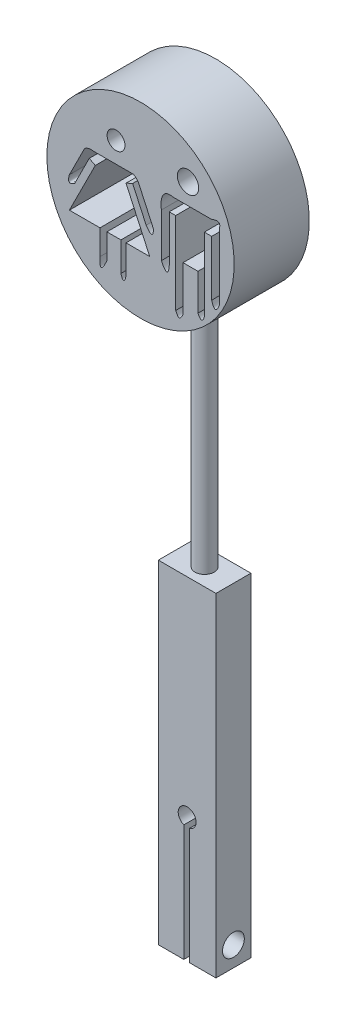
from build123d import *

# Parameters (mm, degrees)
BOSS_EXTRUDE1_DEPTH      = 3.913307776
BOSS_EXTRUDE1_DEPTH_BACK = 0.0001
SKETCH1_W                = 6.447640287
SKETCH1_H                = 37.279047993
SKETCH4_R                = 1.068953687
BOSS_EXTRUDE2_DEPTH      = 37.846
BOSS_EXTRUDE6_DEPTH      = 0.000254
BOSS_EXTRUDE6_DEPTH_BACK = 8.407164958
SKETCH12_R               = 10.48399754
CUT_EXTRUDE4_DEPTH       = 98.663499601
CUT_EXTRUDE4_DEPTH_BACK  = 98.663499601
SKETCH13_R               = 1.19545429
SKETCH13_R_2             = 1.000054771
CUT_EXTRUDE5_DEPTH       = 96.210872711
CUT_EXTRUDE5_DEPTH_BACK  = 96.210872711
SKETCH14_R               = 1
CUT_EXTRUDE6_DEPTH       = 95.94538111
CUT_EXTRUDE6_DEPTH_BACK  = 95.94538111
SKETCH16_W               = 0.623837717
SKETCH16_H               = 17.643046147
CUT_EXTRUDE7_DEPTH       = 83.930679745
CUT_EXTRUDE7_DEPTH_BACK  = 83.930679745
SKETCH17_R               = 1.2192


with BuildPart() as part:
    # Sketch1 → Boss-Extrude1 (new, two sides: drawn at the far end of the back side and taken through both)
    with BuildSketch(Plane.XY.offset(-BOSS_EXTRUDE1_DEPTH_BACK)):
        with Locations((-37.332434681, 14.942660153)):
            Rectangle(SKETCH1_W, SKETCH1_H)
    extrude(amount=BOSS_EXTRUDE1_DEPTH + BOSS_EXTRUDE1_DEPTH_BACK)

    # Sketch4 → Boss-Extrude2 (add)
    with BuildSketch(Plane(origin=(0, 33.582184149, 0), x_dir=(1, 0, 0), z_dir=(0, 1, 0))):
        with Locations((-37.33243468, -1.956603888)):
            Circle(SKETCH4_R)
    extrude(amount=BOSS_EXTRUDE2_DEPTH)

    # Sketch12 → Boss-Extrude6 (add, two sides: drawn at the far end of the back side and taken through both)
    with BuildSketch(Plane(origin=(16.016807469, 0, -0.0001), x_dir=(-1, 0, 0), z_dir=(0, 0, -1)).offset(-BOSS_EXTRUDE6_DEPTH_BACK)):
        with Locations((54.07339326, 70.99141767)):
            Circle(SKETCH12_R)
    extrude(amount=BOSS_EXTRUDE6_DEPTH + BOSS_EXTRUDE6_DEPTH_BACK)

    # Sketch13 → Cut-Extrude4 (cut, two sides: drawn at the far end of the back side and taken through both)
    with BuildSketch(Plane(origin=(4.649934139, 0, -0.000354), x_dir=(-1, 0, 0), z_dir=(0, 0, -1)).offset(-CUT_EXTRUDE4_DEPTH_BACK)):
        with Locations((37.38999626, 76.398428276)):
            Circle(SKETCH13_R)
        with Locations((45.445209714, 76.398428276)):
            Circle(SKETCH13_R_2)
        with BuildLine():
            Line((34.741364568, 74.083543947), (39.031397516, 74.083543947))
            add(Edge.make_bspline(
                [(39.031397516, 74.083543947), (40.611597458, 74.408617634), (40.374079584, 72.184140047)],
                knots=[0, 0, 0, 1, 1, 1], degree=2))
            Line((40.374079584, 72.184140047), (40.374079584, 67.271888579))
            add(Edge.make_bspline(
                [(40.374079584, 67.271888579), (39.600283224, 65.680370015), (39.48987432, 67.271888579)],
                knots=[0, 0, 0, 1, 1, 1], degree=2))
            Line((39.48987432, 67.271888579), (39.48987432, 72.446126791))
            Line((39.48987432, 72.446126791), (38.769410771, 72.446126791))
            Line((38.769410771, 72.446126791), (38.769410771, 63.243842376))
            add(Edge.make_bspline(
                [(38.769410771, 63.243842376), (38.640061856, 62.984463054), (38.377383132, 62.457721647), (38.094358916, 62.979167961), (37.950702193, 63.243842376)],
                knots=[0, 0, 0, 0, 0.492422502, 1, 1, 1, 1], degree=3))
            Line((37.950702193, 63.243842376), (37.950702193, 68.287087216))
            Line((37.950702193, 68.287087216), (36.280536694, 68.287087216))
            Line((36.280536694, 68.287087216), (36.280536694, 64.22629267))
            add(Edge.make_bspline(
                [(36.280536694, 64.22629267), (35.838535516, 63.304970326), (35.560073146, 64.22629267)],
                knots=[0, 0, 0, 1, 1, 1], degree=2))
            Line((35.560073146, 64.22629267), (35.560073146, 72.446126791))
            Line((35.560073146, 72.446126791), (34.741364568, 72.446126791))
            Line((34.741364568, 72.446126791), (34.741364568, 66.256689943))
            add(Edge.make_bspline(
                [(34.741364568, 66.256689943), (34.368924716, 64.879813419), (33.857159304, 66.256689943)],
                knots=[0, 0, 0, 1, 1, 1], degree=2))
            Line((33.857159304, 66.256689943), (33.857159304, 73.723312173))
            add(Edge.make_bspline(
                [(33.857159304, 73.723312173), (33.677043417, 74.525646579), (34.741364568, 74.083543947)],
                knots=[0, 0, 0, 1, 1, 1], degree=2))
        make_face()
        with BuildLine():
            Line((43.52512733, 74.083543947), (47.989647858, 74.083543947))
            add(Edge.make_bspline(
                [(48.956960639, 73.864786766), (48.514088688, 74.173203304), (47.989647858, 74.083543947)],
                knots=[0, 0, 0, 1, 1, 1], degree=2))
            Line((48.956960639, 73.864786766), (50.668360175, 70.451132154))
            add(Edge.make_bspline(
                [(50.067248528, 69.912029472), (51.020492349, 69.269414741), (50.668360175, 70.451132154)],
                knots=[0, 0, 0, 1, 1, 1], degree=2))
            Line((50.067248528, 69.912029472), (48.445579149, 73.146703222))
            Line((48.445579149, 73.146703222), (47.766421831, 72.806214904))
            Line((47.766421831, 72.806214904), (50.668360175, 67.01784404))
            Line((50.668360175, 67.01784404), (47.245561103, 67.01784404))
            Line((47.245561103, 67.01784404), (47.245561103, 64.22629267))
            add(Edge.make_bspline(
                [(46.464270011, 64.22629267), (47.345300679, 62.244581833), (47.245561103, 64.22629267)],
                knots=[0, 0, 0, 1, 1, 1], degree=2))
            Line((46.464270011, 64.22629267), (46.464270011, 67.01784404))
            Line((46.464270011, 67.01784404), (44.901687826, 67.01784404))
            Line((44.901687826, 67.01784404), (44.901687826, 63.767815866))
            add(Edge.make_bspline(
                [(44.328618803, 63.767815866), (44.598060815, 62.719785581), (44.901687826, 63.767815866)],
                knots=[0, 0, 0, 1, 1, 1], degree=2))
            Line((44.328618803, 63.767815866), (44.328618803, 67.01784404))
            Line((44.328618803, 67.01784404), (41.674334103, 67.01784404))
            Line((41.674334103, 67.01784404), (44.328618803, 72.806214904))
            Line((44.328618803, 72.806214904), (43.586093835, 73.146703222))
            Line((43.586093835, 73.146703222), (42.07706345, 69.855862751))
            add(Edge.make_bspline(
                [(41.261473311, 69.907462843), (41.263311056, 68.672431696), (42.07706345, 69.855862751)],
                knots=[0, 0, 0, 1, 1, 1], degree=2))
            Line((41.261473311, 69.907462843), (42.892653588, 73.464683511))
            add(Edge.make_bspline(
                [(43.52512733, 74.083543947), (43.236377665, 73.960792876), (43.025553084, 73.754506064), (42.892653588, 73.464683511)],
                knots=[0, 0, 0, 0, 1, 1, 1, 1], degree=3))
        make_face()
    extrude(amount=CUT_EXTRUDE4_DEPTH + CUT_EXTRUDE4_DEPTH_BACK, mode=Mode.SUBTRACT)

    # Sketch14 → Cut-Extrude5 (cut, two sides: drawn at the far end of the back side and taken through both)
    with BuildSketch(Plane.XY.offset(-CUT_EXTRUDE5_DEPTH_BACK)):
        with Locations((-37.33243468, 10.280474318)):
            Circle(SKETCH14_R)
    extrude(amount=CUT_EXTRUDE5_DEPTH + CUT_EXTRUDE5_DEPTH_BACK, mode=Mode.SUBTRACT)

    # Sketch16 → Cut-Extrude6 (cut, two sides: drawn at the far end of the back side and taken through both)
    with BuildSketch(Plane.XY.offset(3.913307776).offset(-CUT_EXTRUDE6_DEPTH_BACK)):
        with Locations((-37.390631017, 0.740898582)):
            Rectangle(SKETCH16_W, SKETCH16_H)
    extrude(amount=CUT_EXTRUDE6_DEPTH + CUT_EXTRUDE6_DEPTH_BACK, mode=Mode.SUBTRACT)

    # Sketch17 → Cut-Extrude7 (cut, two sides: drawn at the far end of the back side and taken through both)
    with BuildSketch(Plane.ZY.offset(40.556254824).offset(-CUT_EXTRUDE7_DEPTH_BACK)):
        with Locations((1.956603888, -1.45751425)):
            Circle(SKETCH17_R)
    extrude(amount=CUT_EXTRUDE7_DEPTH + CUT_EXTRUDE7_DEPTH_BACK, mode=Mode.SUBTRACT)


solid = part.part
